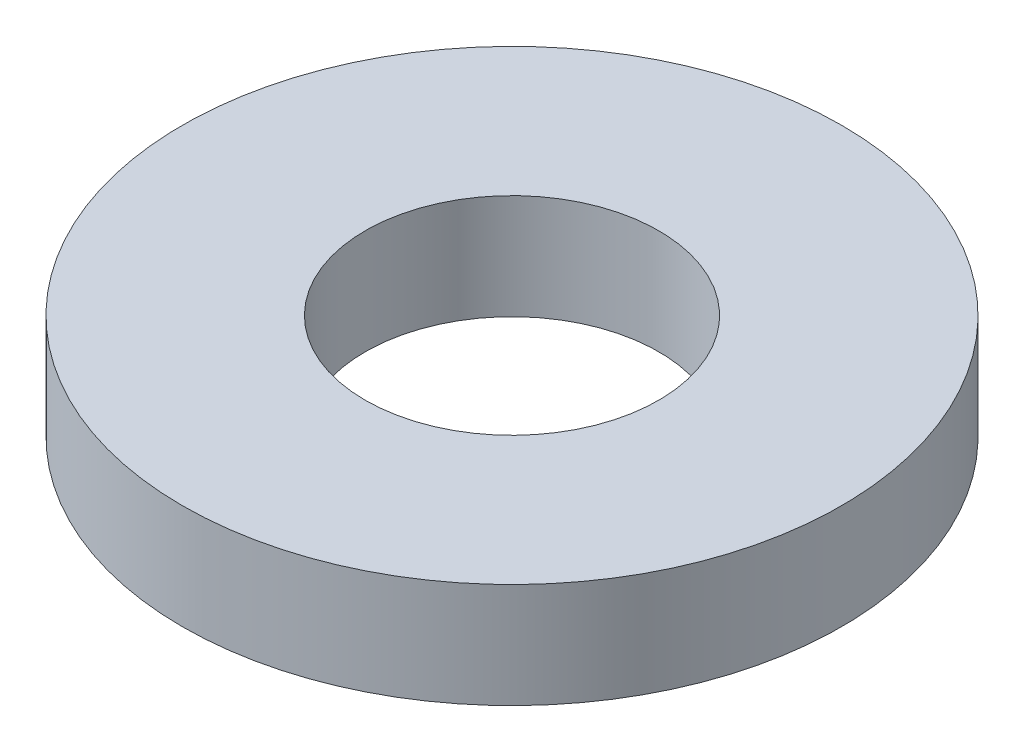
from build123d import *

# Parameters (mm, degrees)
SKETCH1_R           = 5.588
SKETCH1_R_2         = 2.4892
BOSS_EXTRUDE1_DEPTH = 1.778


with BuildPart() as part:
    # Sketch1 → Boss-Extrude1 (new body)
    with BuildSketch(Plane(origin=(0, 0, 0), x_dir=(1, 0, 0), z_dir=(0, 1, 0))):
        with Locations(Location((0, 0, 0), (0, 0, 270))):
            Circle(SKETCH1_R)
        with Locations(Location((0, 0, 0), (0, 0, 270))):
            Circle(SKETCH1_R_2, mode=Mode.SUBTRACT)
    extrude(amount=BOSS_EXTRUDE1_DEPTH)


solid = part.part
